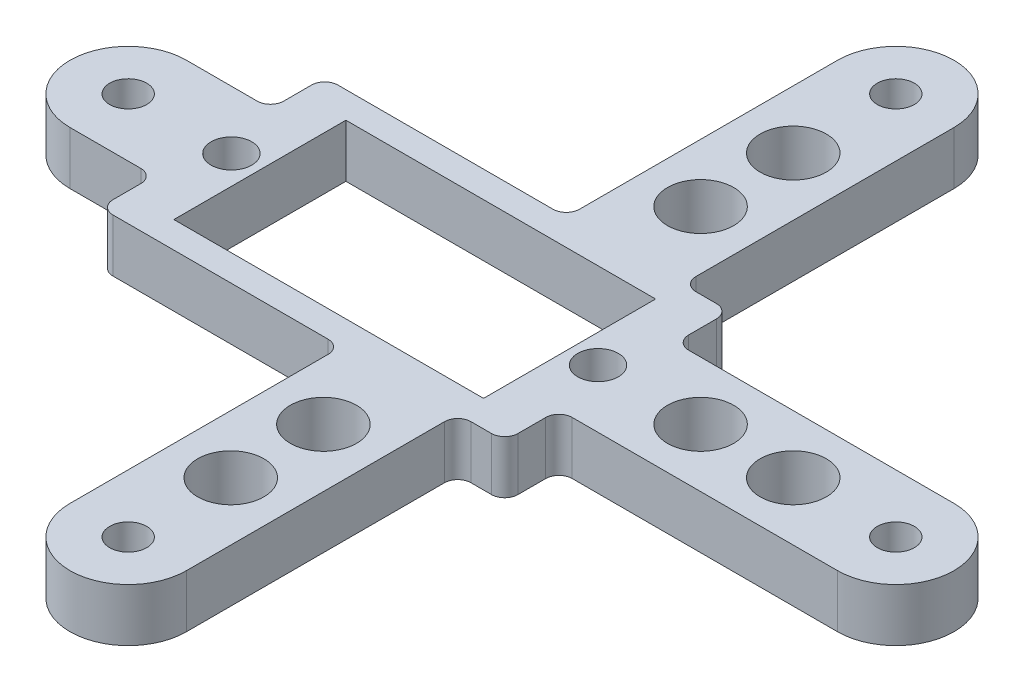
from build123d import *

# Parameters (mm, degrees)
SKETCH2_R               = 1.4
SKETCH2_R_2             = 1.535241885
SKETCH2_W               = 23.4
SKETCH2_H               = 13
BOSS_EXTRUDE2_DEPTH     = 4
CUT_EXTRUDE3_DEPTH      = 48.403797316
CUT_EXTRUDE3_DEPTH_BACK = 48.403797316
SKETCH3_R               = 2.5
FILLET1_R               = 1


with BuildPart() as part:
    # Sketch2 → Boss-Extrude2 (new body)
    with BuildSketch(Plane(origin=(0, 0, 0), x_dir=(1, 0, 0), z_dir=(0, 1, 0))):
        with BuildLine():
            Line((29, 4.4), (7.95, 4.4))
            Line((7.95, 4.4), (7.95, 8.5))
            Line((7.95, 8.5), (4.4, 8.5))
            Line((4.4, 8.5), (4.4, 29))
            ThreePointArc((4.4, 29), (0, 33.4), (-4.4, 29))
            Line((-4.4, 29), (-4.4, 8.5))
            Line((-4.4, 8.5), (-22.65, 8.5))
            Line((-22.65, 8.5), (-22.65, 4.4))
            Line((-22.65, 4.4), (-29, 4.4))
            ThreePointArc((-29, 4.4), (-33.4, 0), (-29, -4.4))
            Line((-29, -4.4), (-22.65, -4.4))
            Line((-22.65, -4.4), (-22.65, -8.5))
            Line((-22.65, -8.5), (-4.4, -8.5))
            Line((-4.4, -8.5), (-4.4, -29))
            ThreePointArc((-4.4, -29), (0, -33.4), (4.4, -29))
            Line((4.4, -29), (4.4, -8.5))
            Line((4.4, -8.5), (7.95, -8.5))
            Line((7.95, -8.5), (7.95, -4.4))
            Line((7.95, -4.4), (29, -4.4))
            ThreePointArc((29, -4.4), (33.4, 0), (29, 4.4))
        make_face()
        with Locations(Location((0, 29, 0), (0, 0, 270))):
            Circle(SKETCH2_R, mode=Mode.SUBTRACT)
        with Locations(Location((29, 0, 0), (0, 0, 270))):
            Circle(SKETCH2_R, mode=Mode.SUBTRACT)
        with Locations(Location((0, -29, 0), (0, 0, 90))):
            Circle(SKETCH2_R, mode=Mode.SUBTRACT)
        with Locations(Location((-29, 0, 0), (0, 0, 90))):
            Circle(SKETCH2_R, mode=Mode.SUBTRACT)
        with Locations(Location((6.5, 0, 0), (0, 0, 270))):
            Circle(SKETCH2_R_2, mode=Mode.SUBTRACT)
        with Locations(Location((-21.2, 0, 0), (0, 0, 270))):
            Circle(SKETCH2_R_2, mode=Mode.SUBTRACT)
        with Locations((-7.35, 0)):
            Rectangle(SKETCH2_W, SKETCH2_H, mode=Mode.SUBTRACT)
    extrude(amount=BOSS_EXTRUDE2_DEPTH)

    # Sketch3 → Cut-Extrude3 (cut, two sides: drawn at the far end of the back side and taken through both)
    with BuildSketch(Plane(origin=(0, 0, 0), x_dir=(1, 0, 0), z_dir=(0, 1, 0)).offset(-CUT_EXTRUDE3_DEPTH_BACK)):
        with Locations(Location((0, 21.25, 0), (0, 0, 270))):
            Circle(SKETCH3_R)
        with Locations(Location((0, 14.25, 0), (0, 0, 270))):
            Circle(SKETCH3_R)
        with Locations(Location((14.25, 0, 0), (0, 0, 270))):
            Circle(SKETCH3_R)
        with Locations(Location((21.25, 0, 0), (0, 0, 270))):
            Circle(SKETCH3_R)
        with Locations(Location((0, -14.25, 0), (0, 0, 270))):
            Circle(SKETCH3_R)
        with Locations(Location((0, -21.25, 0), (0, 0, 270))):
            Circle(SKETCH3_R)
    extrude(amount=CUT_EXTRUDE3_DEPTH + CUT_EXTRUDE3_DEPTH_BACK, mode=Mode.SUBTRACT)

    # Fillet1
    fillet1_edges = [part.edges().sort_by_distance(p)[0] for p in [
        (7.95, 2, 4.4),
        (7.95, 2, 8.5),
        (4.4, 2, 8.5),
        (-4.4, 2, 8.5),
        (-22.65, 2, 8.5),
        (-22.65, 2, 4.4),
        (-22.65, 2, -4.4),
        (-22.65, 2, -8.5),
        (-4.4, 2, -8.5),
        (4.4, 2, -8.5),
        (7.95, 2, -8.5),
        (7.95, 2, -4.4),
    ]]
    fillet(fillet1_edges, radius=FILLET1_R)


solid = part.part
